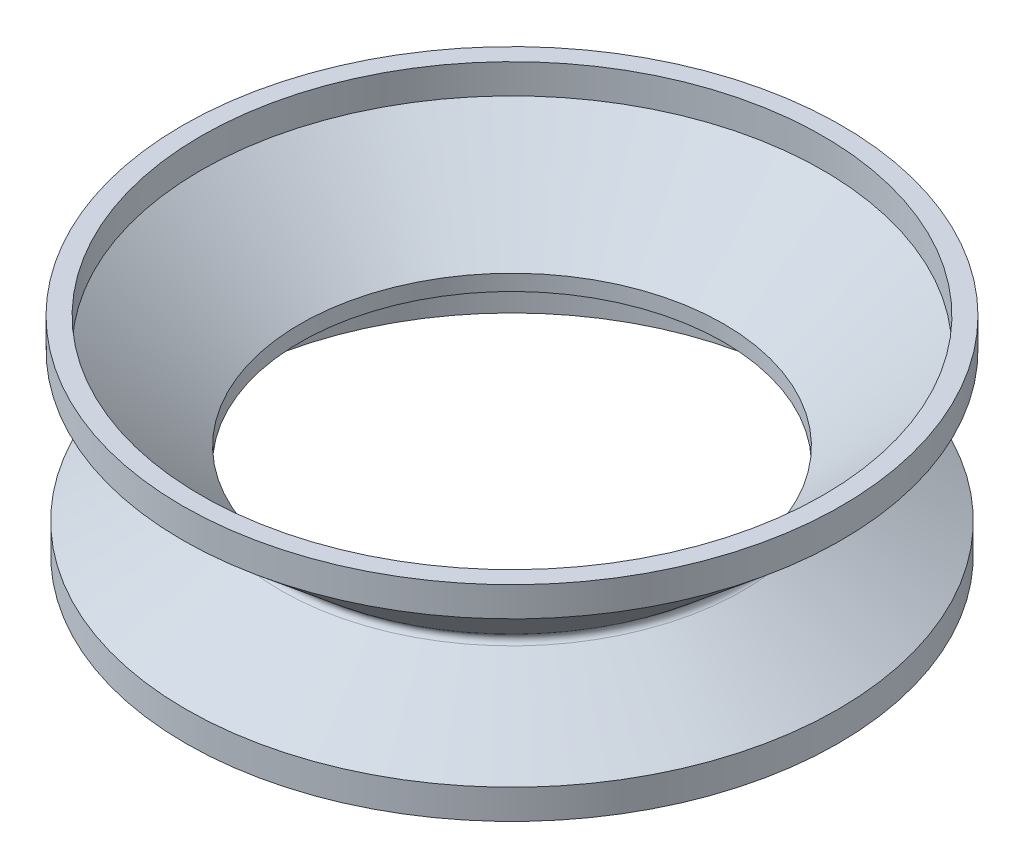
from build123d import *

# Parameters (mm, degrees)
FILLET2_R           = 0.4
SKETCH2_R           = 22.244579061
SKETCH2_R_2         = 21
BOSS_EXTRUDE1_DEPTH = 2
SKETCH3_R           = 22.022260736
SKETCH3_R_2         = 20.022260736
BOSS_EXTRUDE2_DEPTH = 2


with BuildPart() as part:
    # Sketch1 → Revolve1 (revolve)
    with BuildSketch(Plane.XY, mode=Mode.PRIVATE) as revolve1_sk:
        Polygon((0.662781953, 0), (-6.487739603, 6), (-5.243160541, 6), (1.462781953, 0.373046127), (1.462781953, -0.692820323), (-4.265421278, -4), (-6.265421278, -4), align=None)
    revolve(revolve1_sk.sketch.rotate(Axis((15.756839459, 5.609018033, 0), (0, -1, 0)), 270), axis=Axis((15.756839459, 5.609018033, 0), (0, -1, 0)))

    # Fillet2
    fillet2_edges = [part.edges().sort_by_distance(p)[0] for p in [
        (15.756839459, 0, -15.094057506),
    ]]
    fillet(fillet2_edges, radius=FILLET2_R)

    # Sketch2 → Boss-Extrude1 (add)
    with BuildSketch(Plane(origin=(0, 6, 0), x_dir=(1, 0, 0), z_dir=(0, 1, 0))):
        with Locations(Location((15.756839459, 0, 0), (0, 0, 270))):
            Circle(SKETCH2_R)
        with Locations(Location((15.756839459, 0, 0), (0, 0, 180))):
            Circle(SKETCH2_R_2, mode=Mode.SUBTRACT)
    extrude(amount=BOSS_EXTRUDE1_DEPTH)

    # Sketch3 → Boss-Extrude2 (add)
    with BuildSketch(Plane.XZ.offset(4)):
        with Locations((15.756839459, 0)):
            Circle(SKETCH3_R)
        with Locations(Location((15.756839459, 0, 0), (0, 0, 90))):
            Circle(SKETCH3_R_2, mode=Mode.SUBTRACT)
    extrude(amount=BOSS_EXTRUDE2_DEPTH)


solid = part.part
